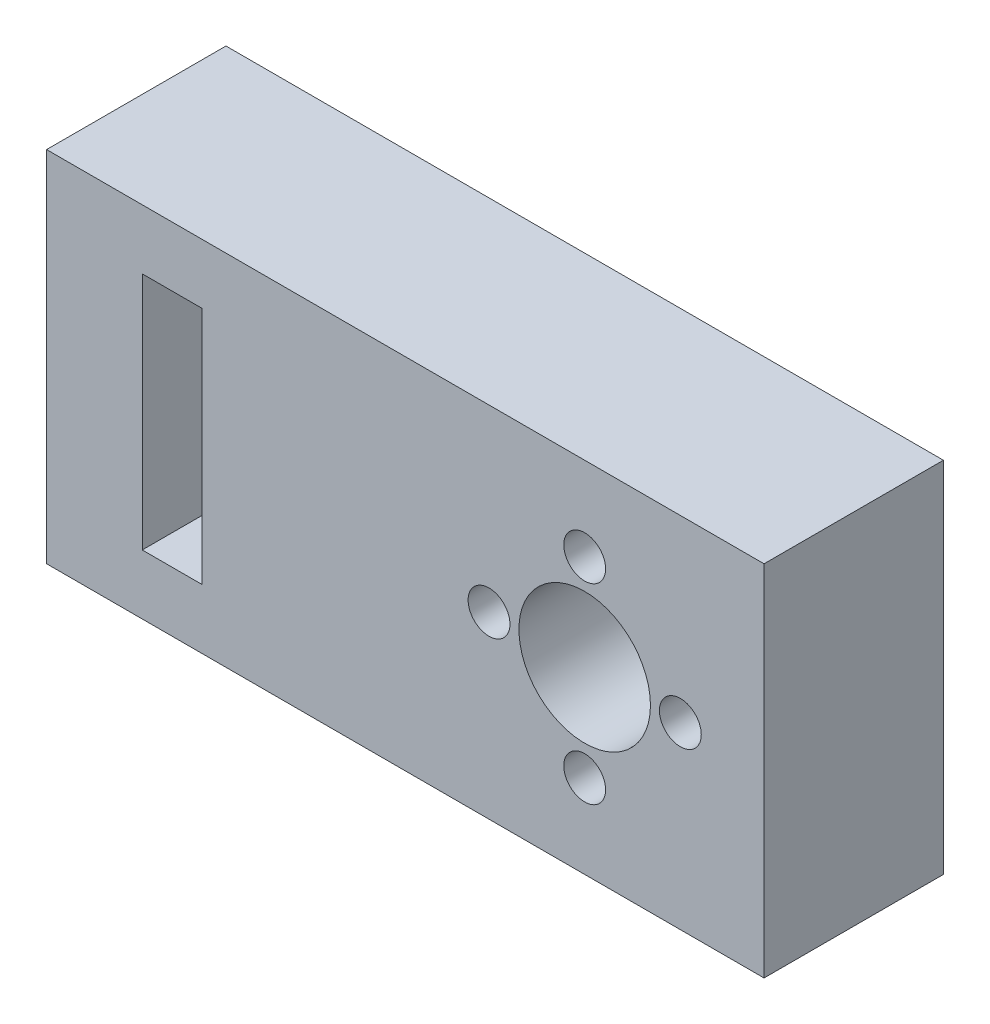
from build123d import *

# Parameters (mm, degrees)
SKETCH1_W           = 60
SKETCH1_H           = 30
SKETCH1_R           = 5.5
SKETCH1_R_2         = 1.75
SKETCH1_W_2         = 5
SKETCH1_H_2         = 20
BOSS_EXTRUDE1_DEPTH = 7.5
SKETCH2_R           = 2.5
CUT_EXTRUDE1_DEPTH  = 8


with BuildPart() as part:
    # Sketch1 → Boss-Extrude1 (new, symmetric)
    with BuildSketch(Plane.XY):
        Rectangle(SKETCH1_W, SKETCH1_H)
        with Locations((15, 0)):
            Circle(SKETCH1_R, mode=Mode.SUBTRACT)
        with Locations((15, 8)):
            Circle(SKETCH1_R_2, mode=Mode.SUBTRACT)
        with Locations((23, 0)):
            Circle(SKETCH1_R_2, mode=Mode.SUBTRACT)
        with Locations((15, -8)):
            Circle(SKETCH1_R_2, mode=Mode.SUBTRACT)
        with Locations((7, 0)):
            Circle(SKETCH1_R_2, mode=Mode.SUBTRACT)
        with Locations((-19.5, 0)):
            Rectangle(SKETCH1_W_2, SKETCH1_H_2, mode=Mode.SUBTRACT)
    extrude(amount=BOSS_EXTRUDE1_DEPTH, both=True)

    # Sketch2 → Cut-Extrude1 (cut)
    with BuildSketch(Plane.ZY.offset(30)):
        with Locations(Location((0, 0, 0), (0, 0, 270))):
            Circle(SKETCH2_R)
    extrude(amount=-CUT_EXTRUDE1_DEPTH, mode=Mode.SUBTRACT)


solid = part.part
